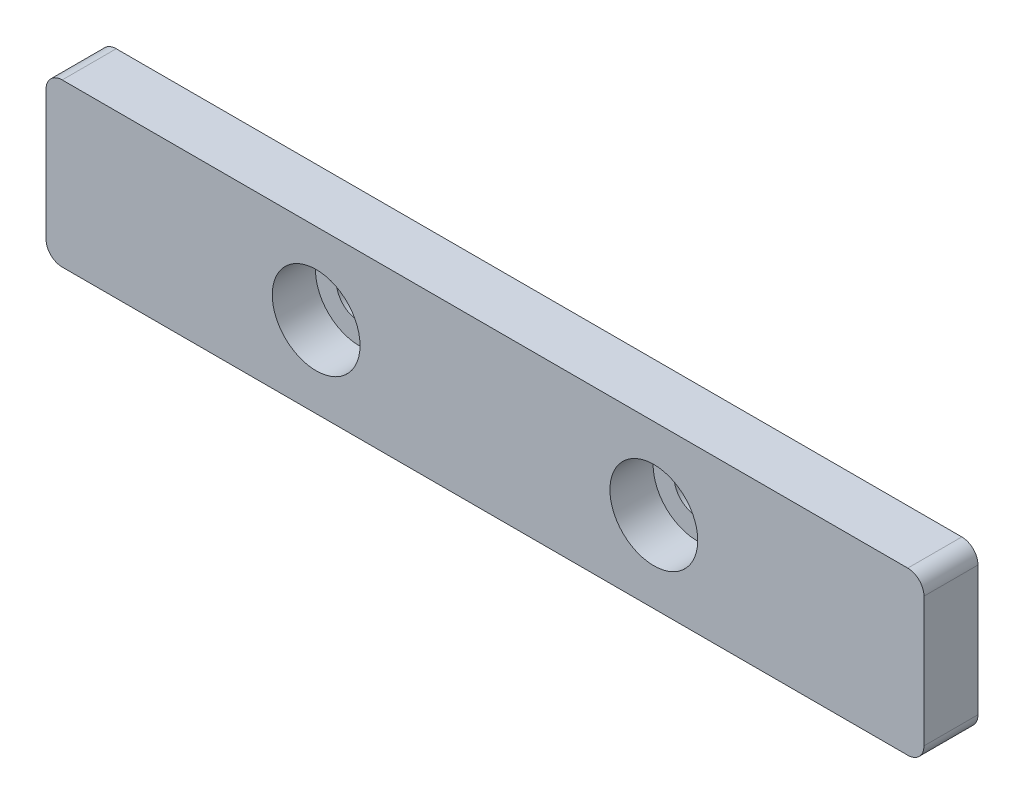
from build123d import *

# Parameters (mm, degrees)
SKIZZE2_W                       = 65
SKIZZE2_H                       = 12
AUFSATZ_LINEAR_AUSTRAGEN1_DEPTH = 4
SKIZZE3_R                       = 1.7
SCHNITT_LINEAR_AUSTRAGEN1_DEPTH = 70.241173381
SKIZZE4_R                       = 3.25
SCHNITT_LINEAR_AUSTRAGEN2_DEPTH = 3.2
VERRUNDUNG3_R                   = 1.2


with BuildPart() as part:
    # Skizze2 → Aufsatz-Linear austragen1 (new body)
    with BuildSketch(Plane.XY.offset(18)):
        with Locations((34.289745228, 11.817688499)):
            Rectangle(SKIZZE2_W, SKIZZE2_H)
    extrude(amount=AUFSATZ_LINEAR_AUSTRAGEN1_DEPTH)

    # Skizze3 → Schnitt-Linear austragen1 (cut, through all)
    with BuildSketch(Plane.XY.offset(22)):
        with Locations((21.789745228, 11.817688499)):
            Circle(SKIZZE3_R)
        with Locations((46.789745228, 11.817688499)):
            Circle(SKIZZE3_R)
    extrude(amount=-SCHNITT_LINEAR_AUSTRAGEN1_DEPTH, mode=Mode.SUBTRACT)

    # Skizze4 → Schnitt-Linear austragen2 (cut)
    with BuildSketch(Plane.XY.offset(22)):
        with Locations((21.789745228, 11.817688499)):
            Circle(SKIZZE4_R)
        with Locations((46.789745228, 11.817688499)):
            Circle(SKIZZE4_R)
    extrude(amount=-SCHNITT_LINEAR_AUSTRAGEN2_DEPTH, mode=Mode.SUBTRACT)

    # Verrundung3
    verrundung3_edges = [part.edges().sort_by_distance(p)[0] for p in [
        (1.789745228, 17.817688499, 20),
        (66.789745228, 17.817688499, 20),
        (66.789745228, 5.817688499, 20),
        (1.789745228, 5.817688499, 20),
    ]]
    fillet(verrundung3_edges, radius=VERRUNDUNG3_R)


solid = part.part
